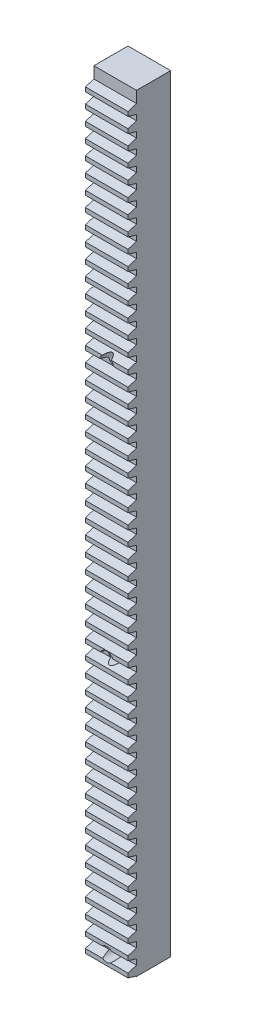
from build123d import *

# Parameters (mm, degrees)
SKETCH_1_W             = 8
SKETCH_1_H             = 180
EXTRUDE_1_DEPTH        = 5
EXTRUDE_2_DEPTH        = 5
PATTERN_LINEAR_1_COUNT = 51
PATTERN_LINEAR_1_PITCH = 3.5
SKETCH_3_R             = 1.6
CUT_EXTRUDE_1_DEPTH    = 91.691785736


with BuildPart() as part:
    # 草图1 → 凸台-拉伸1 (new, symmetric)
    with BuildSketch(Plane(origin=(0, 0, 0), x_dir=(0, 0, -1), z_dir=(1, 0, 0))):
        with Locations((4, 0)):
            Rectangle(SKETCH_1_W, SKETCH_1_H)
    extrude(amount=EXTRUDE_1_DEPTH, both=True)

    # 草图2 → 凸台-拉伸2 (add, symmetric)
    with BuildSketch(Plane(origin=(0, 0, 0), x_dir=(0, 0, -1), z_dir=(1, 0, 0))):
        Polygon((0, -89.9), (-2, -89.3), (-2, -88.3), (0, -87.7), align=None)
    extrude_2 = extrude(amount=EXTRUDE_2_DEPTH, both=True)

    # 阵列(线性)1: 凸台-拉伸2 ×51
    with Locations(*[(0, i * PATTERN_LINEAR_1_PITCH, 0) for i in range(1, PATTERN_LINEAR_1_COUNT)]):
        add(extrude_2)

    # 草图3 → 切除-拉伸1 (cut, through all)
    with BuildSketch(Plane(origin=(0, 0, -8), x_dir=(-1, 0, 0), z_dir=(0, 0, -1))):
        with Locations((0, -87)):
            Circle(SKETCH_3_R)
        with Locations((0, -27)):
            Circle(SKETCH_3_R)
        with Locations((0, 33)):
            Circle(SKETCH_3_R)
    extrude(amount=-CUT_EXTRUDE_1_DEPTH, mode=Mode.SUBTRACT)


solid = part.part
